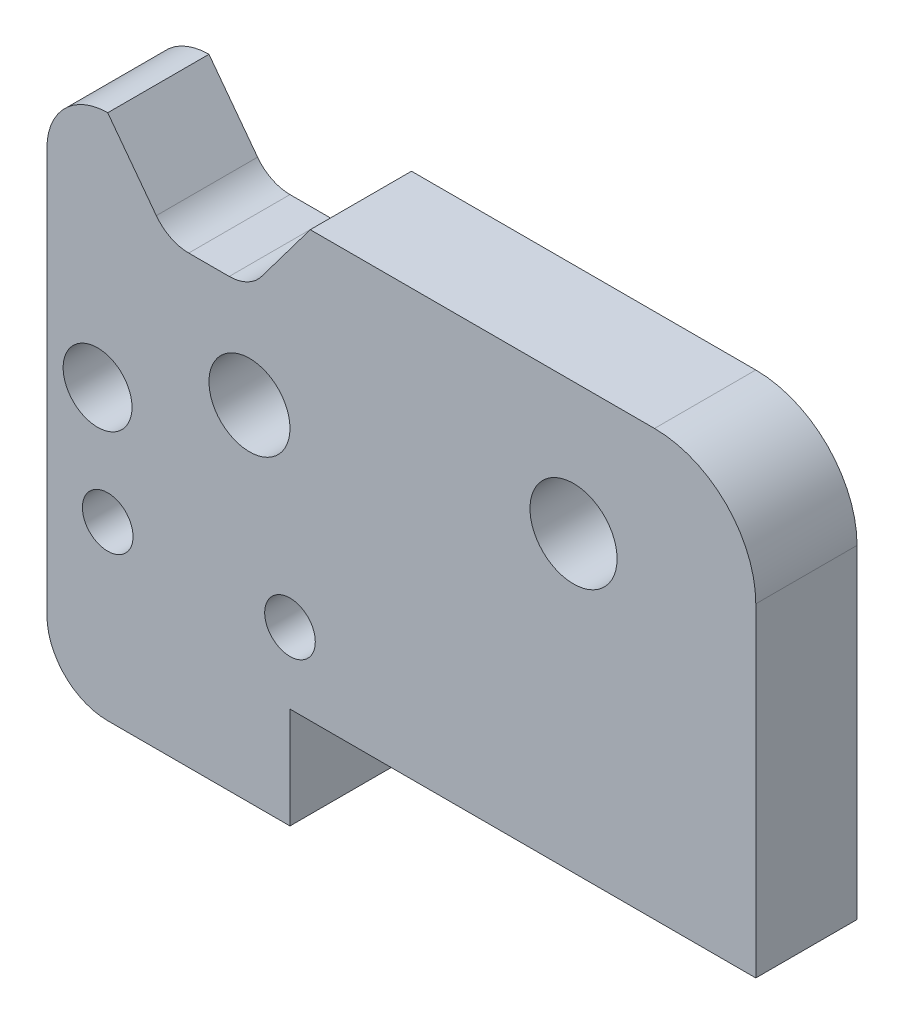
from build123d import *

# Parameters (mm, degrees)
SKETCH1_W             = 23
SKETCH1_H             = 21
EXTRUDE1_DEPTH        = 5
SKETCH2_R             = 2.15
EXTRUDE2_DEPTH        = 4.5
SKETCH4_R             = 1.25
EXTRUDE4_DEPTH        = 8
FILLET1_R             = 5
SKETCH6_R             = 2.05
EXTRUDE6_DEPTH        = 4.5
SKETCH9_W             = 12
SKETCH9_H             = 26
EXTRUDE9_DEPTH        = 5
SKETCH11_R            = 1.7
EXTRUDE11_DEPTH       = 5
SKETCH10_R            = 2
EXTRUDE10_DEPTH       = 4
M3_TAPPED_HOLE1_D     = 2.5
M3_TAPPED_HOLE1_DEPTH = 8
M3_TAPPED_HOLE1_TIP   = 0.751075774
FILLET3_R             = 3
EXTRUDE15_DEPTH       = 5
FILLET6_R             = 2
SKETCH16_R            = 0.75
EXTRUDE16_DEPTH       = 5
M3_TAPPED_HOLE2_D     = 2.5
M3_TAPPED_HOLE2_DEPTH = 7.5
M3_TAPPED_HOLE2_TIP   = 0.751075774


with BuildPart() as part:
    # Sketch1 → Extrude1 (new body)
    with BuildSketch(Plane.XY):
        with Locations((3.5, -4)):
            Rectangle(SKETCH1_W, SKETCH1_H)
    extrude(amount=EXTRUDE1_DEPTH)

    # Sketch2 → Extrude2 (cut)
    with BuildSketch(Plane.XY.offset(5)):
        with Locations((6, 0)):
            Circle(SKETCH2_R)
    extrude(amount=-EXTRUDE2_DEPTH, mode=Mode.SUBTRACT)

    # Sketch4 → Extrude4 (cut)
    with BuildSketch(Plane.XZ.offset(14.5)):
        with Locations(Location((-1.4, 2.5, 0), (0, 0, 270))):
            Circle(SKETCH4_R)
        with Locations(Location((12, 2.5, 0), (0, 0, 270))):
            Circle(SKETCH4_R)
    extrude(amount=-EXTRUDE4_DEPTH, mode=Mode.SUBTRACT)

    # Fillet1
    fillet1_edges = [part.edges().sort_by_distance(p)[0] for p in [
        (15, 6.5, 2.5),
    ]]
    fillet(fillet1_edges, radius=FILLET1_R)

    # Sketch6 → Extrude6 (cut)
    with BuildSketch(Plane(origin=(0, 0, 0), x_dir=(-1, 0, 0), z_dir=(0, 0, -1))):
        with Locations((-4.9, -6.5)):
            Circle(SKETCH6_R)
    extrude(amount=-EXTRUDE6_DEPTH, mode=Mode.SUBTRACT)

    # Sketch9 → Extrude9 (add)
    with BuildSketch(Plane(origin=(0, 0, 0), x_dir=(-1, 0, 0), z_dir=(0, 0, -1))):
        with Locations((14, -6.5)):
            Rectangle(SKETCH9_W, SKETCH9_H)
    extrude(amount=-EXTRUDE9_DEPTH)

    # Sketch11 → Extrude11 (cut)
    with BuildSketch(Plane.XY.offset(5)):
        with Locations((-17.5, -5.5)):
            Circle(SKETCH11_R)
    extrude(amount=-EXTRUDE11_DEPTH, mode=Mode.SUBTRACT)

    # Sketch10 → Extrude10 (cut)
    with BuildSketch(Plane.XY.offset(5)):
        with Locations((-10, -2.5)):
            Circle(SKETCH10_R)
    extrude(amount=-EXTRUDE10_DEPTH, mode=Mode.SUBTRACT)

    # M3 Tapped Hole1
    with Locations(Plane(origin=(-1.4, -14.5, 2.5), x_dir=(0, 0, -1), z_dir=(0, -1, 0))):
        with Locations((0, 0), (0, 13.4)):
            Hole(M3_TAPPED_HOLE1_D / 2, depth=M3_TAPPED_HOLE1_DEPTH)
            with Locations((0, 0, -(M3_TAPPED_HOLE1_DEPTH + M3_TAPPED_HOLE1_TIP / 2))):  # 118° drill point
                Cone(0, M3_TAPPED_HOLE1_D / 2, M3_TAPPED_HOLE1_TIP, mode=Mode.SUBTRACT)

    # Fillet3
    fillet3_edges = [part.edges().sort_by_distance(p)[0] for p in [
        (-20, -19.5, 2.5),
        (-20, 6.5, 2.5),
    ]]
    fillet(fillet3_edges, radius=FILLET3_R)

    # Sketch15 → Extrude15 (cut)
    with BuildSketch(Plane.XY.offset(5)):
        Polygon((-14, 2.5), (-17, 6.5), (-7, 6.5), (-10, 2.5), align=None)
    extrude(amount=-EXTRUDE15_DEPTH, mode=Mode.SUBTRACT)

    # Fillet6
    fillet6_edges = [part.edges().sort_by_distance(p)[0] for p in [
        (-10, 2.5, 2.5),
        (-14, 2.5, 2.5),
    ]]
    fillet(fillet6_edges, radius=FILLET6_R)

    # Sketch16 → Extrude16 (cut)
    with BuildSketch(Plane(origin=(0, 0, 0), x_dir=(-1, 0, 0), z_dir=(0, 0, -1))):
        with Locations((17, -11)):
            Circle(SKETCH16_R)
        with Locations((8, -11)):
            Circle(SKETCH16_R)
    extrude(amount=-EXTRUDE16_DEPTH, mode=Mode.SUBTRACT)

    # M3 Tapped Hole2
    with Locations(Plane(origin=(-8, -11, 0), x_dir=(-1, 0, 0), z_dir=(0, 0, -1))):
        with Locations((0, 0), (9, 0)):
            Hole(M3_TAPPED_HOLE2_D / 2, depth=M3_TAPPED_HOLE2_DEPTH)
            with Locations((0, 0, -(M3_TAPPED_HOLE2_DEPTH + M3_TAPPED_HOLE2_TIP / 2))):  # 118° drill point
                Cone(0, M3_TAPPED_HOLE2_D / 2, M3_TAPPED_HOLE2_TIP, mode=Mode.SUBTRACT)


solid = part.part
